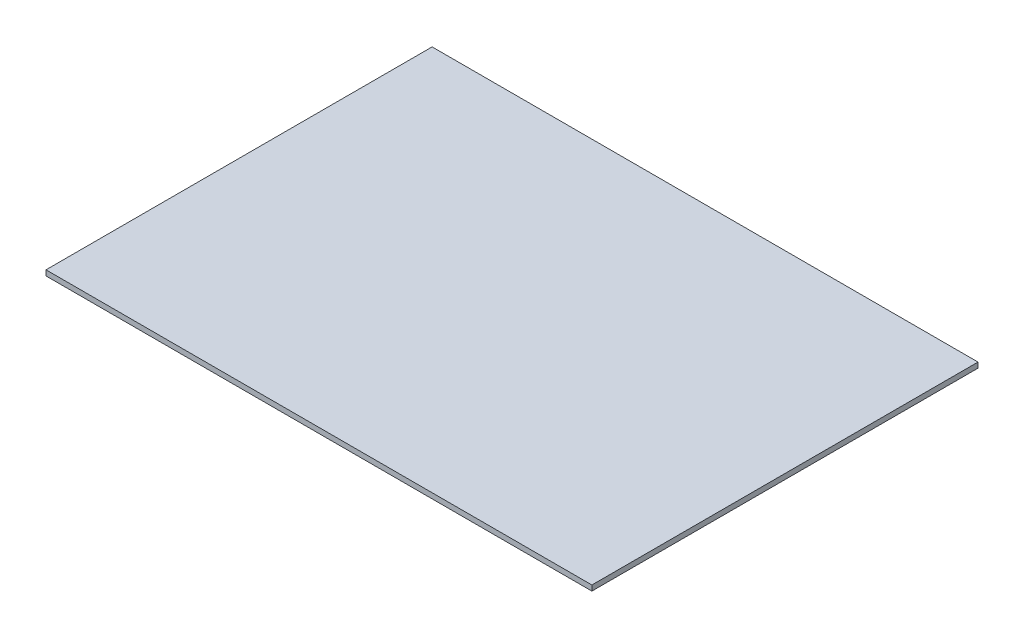
from build123d import *

# Parameters (mm, degrees)
SKETCH_1_W      = 410
SKETCH_1_H      = 290
EXTRUDE_1_DEPTH = 4


with BuildPart() as part:
    # 草图1 → 凸台-拉伸1 (new body)
    with BuildSketch(Plane(origin=(0, 0, 0), x_dir=(1, 0, 0), z_dir=(0, 1, 0))):
        Rectangle(SKETCH_1_W, SKETCH_1_H)
    extrude(amount=EXTRUDE_1_DEPTH)


solid = part.part
